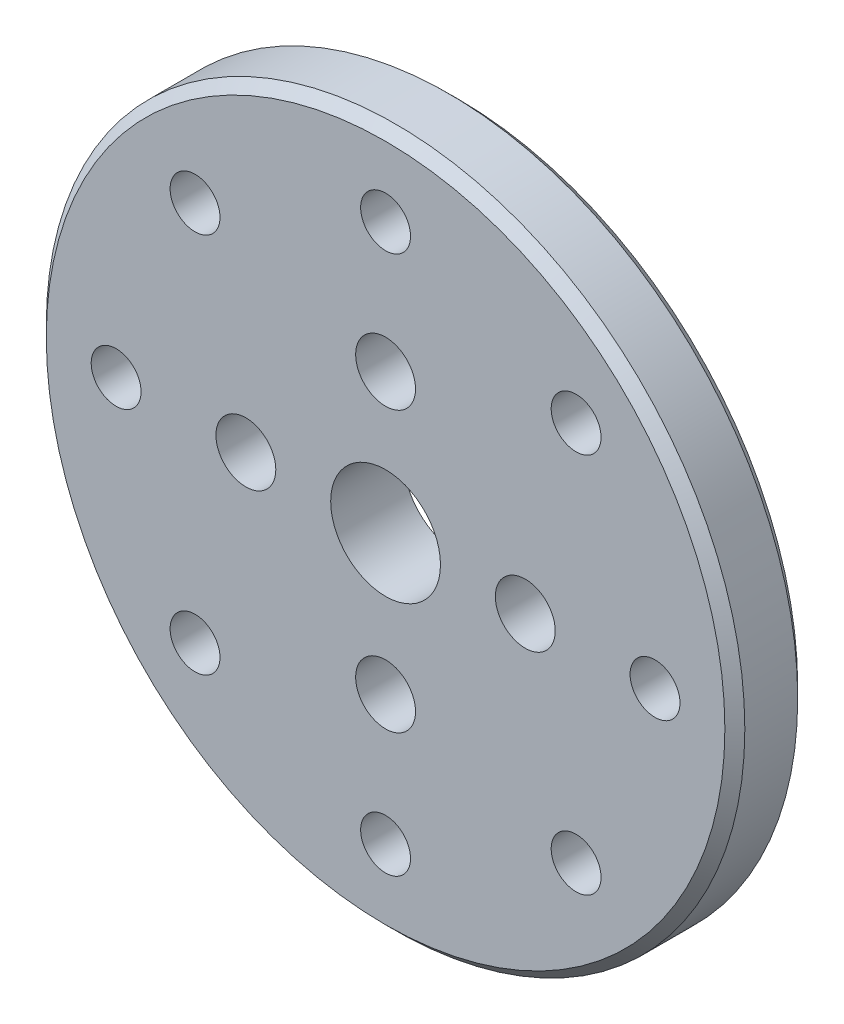
from build123d import *

# Parameters (mm, degrees)
SKETCH_1_R          = 17.5
EXTRUDE_1_DEPTH     = 3.65
SKETCH_3_R          = 1.25
CUT_EXTRUDE_1_DEPTH = 5
CHAMFER_1_SIZE      = 0.5
SKETCH_4_R          = 1.5
CUT_EXTRUDE_2_DEPTH = 10
SKETCH_5_R          = 2.75
CUT_EXTRUDE_3_DEPTH = 10


with BuildPart() as part:
    # 草图1 → 凸台-拉伸1 (new body)
    with BuildSketch(Plane.XY):
        Circle(SKETCH_1_R)
    extrude(amount=EXTRUDE_1_DEPTH)

    # 草图3 → 切除-拉伸1 (cut)
    with BuildSketch(Plane(origin=(0, 0, 0), x_dir=(-1, 0, 0), z_dir=(0, 0, -1))):
        with Locations((0, 13.5)):
            Circle(SKETCH_3_R)
        with Locations((9.545941546, 9.545941546)):
            Circle(SKETCH_3_R)
        with Locations((13.5, 0)):
            Circle(SKETCH_3_R)
        with Locations((9.545941546, -9.545941546)):
            Circle(SKETCH_3_R)
        with Locations((0, -13.5)):
            Circle(SKETCH_3_R)
        with Locations((-9.545941546, -9.545941546)):
            Circle(SKETCH_3_R)
        with Locations((-13.5, 0)):
            Circle(SKETCH_3_R)
        with Locations((-9.545941546, 9.545941546)):
            Circle(SKETCH_3_R)
    extrude(amount=-CUT_EXTRUDE_1_DEPTH, mode=Mode.SUBTRACT)

    # 倒角1
    chamfer_1_edges = [part.edges().sort_by_distance(p)[0] for p in [
        (-17.5, 0, 0),
        (-17.5, 0, 3.65),
    ]]
    chamfer(chamfer_1_edges, length=CHAMFER_1_SIZE)

    # 草图4 → 切除-拉伸2 (cut)
    with BuildSketch(Plane(origin=(0, 0, 0), x_dir=(-1, 0, 0), z_dir=(0, 0, -1))):
        with Locations((0, 7)):
            Circle(SKETCH_4_R)
        with Locations((7, 0)):
            Circle(SKETCH_4_R)
        with Locations((0, -7)):
            Circle(SKETCH_4_R)
        with Locations((-7, 0)):
            Circle(SKETCH_4_R)
    extrude(amount=-CUT_EXTRUDE_2_DEPTH, mode=Mode.SUBTRACT)

    # 草图5 → 切除-拉伸3 (cut)
    with BuildSketch(Plane(origin=(0, 0, 0), x_dir=(-1, 0, 0), z_dir=(0, 0, -1))):
        Circle(SKETCH_5_R)
    extrude(amount=-CUT_EXTRUDE_3_DEPTH, mode=Mode.SUBTRACT)


solid = part.part
